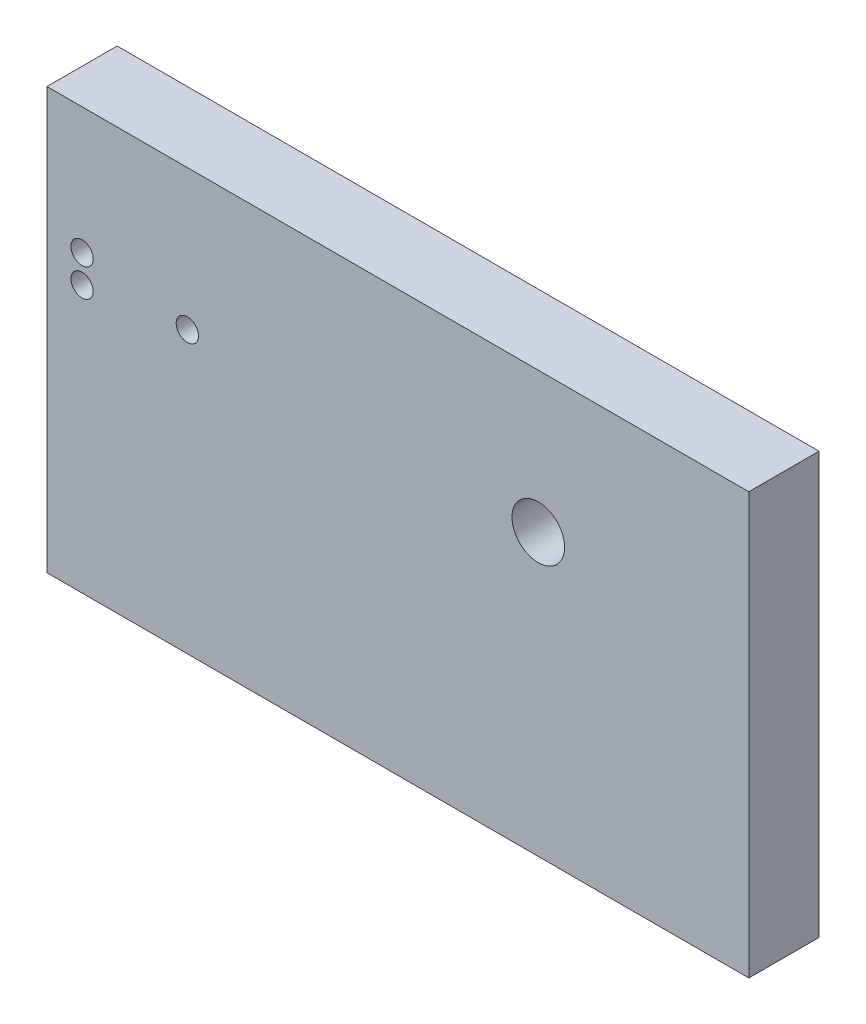
from build123d import *

# Parameters (mm, degrees)
SKETCH1_W                       = 127
SKETCH1_H                       = 76.2
BOSS_EXTRUDE1_DEPTH             = 12.7
F_1_32_0_159_DIAMETER_HOLE1_D   = 4.0386
F_10_32_TAPPED_HOLE1_D          = 4.0386
F_10_32_TAPPED_HOLE1_DEPTH      = 11.486682152
F_10_32_TAPPED_HOLE1_TIP        = 1.213317848
F_3_8_0_375_DIAMETER_HOLE1_D    = 9.525
F_10_32_TAPPED_HOLE2_D          = 4.0386
F_10_32_TAPPED_HOLE2_DEPTH      = 14.478
F_10_32_TAPPED_HOLE2_TIP        = 1.213317848
F_21_0_159_DIAMETER_HOLE1_D     = 4.0386
F_21_0_159_DIAMETER_HOLE1_DEPTH = 14.478
F_21_0_159_DIAMETER_HOLE1_TIP   = 1.213317848


with BuildPart() as part:
    # Sketch1 → Boss-Extrude1 (new body)
    with BuildSketch(Plane.XY):
        with Locations((63.5, 38.1)):
            Rectangle(SKETCH1_W, SKETCH1_H)
    extrude(amount=BOSS_EXTRUDE1_DEPTH)

    # 1/32 (0.159) Diameter Hole1 (through all)
    with Locations(Plane.XY.offset(12.7)):
        with Locations((25.4, 50.8)):
            Hole(F_1_32_0_159_DIAMETER_HOLE1_D / 2)

    # #10-32 Tapped Hole1
    with Locations(Plane(origin=(0, 0, 0), x_dir=(-1, 0, 0), z_dir=(0, -1, 0))):
        with Locations((-19.05, -6.35), (-107.95, -6.35)):
            Hole(F_10_32_TAPPED_HOLE1_D / 2, depth=F_10_32_TAPPED_HOLE1_DEPTH)
            with Locations((0, 0, -(F_10_32_TAPPED_HOLE1_DEPTH + F_10_32_TAPPED_HOLE1_TIP / 2))):  # 118° drill point
                Cone(0, F_10_32_TAPPED_HOLE1_D / 2, F_10_32_TAPPED_HOLE1_TIP, mode=Mode.SUBTRACT)

    # 3/8 (0.375) Diameter Hole1 (through all)
    with Locations(Plane.XY.offset(12.7)):
        with Locations((88.9, 50.8)):
            Hole(F_3_8_0_375_DIAMETER_HOLE1_D / 2)

    # #10-32 Tapped Hole2
    with Locations(Plane.XY.offset(12.7)):
        with Locations((6.35, 48.26)):
            Hole(F_10_32_TAPPED_HOLE2_D / 2, depth=F_10_32_TAPPED_HOLE2_DEPTH)
            with Locations((0, 0, -(F_10_32_TAPPED_HOLE2_DEPTH + F_10_32_TAPPED_HOLE2_TIP / 2))):  # 118° drill point
                Cone(0, F_10_32_TAPPED_HOLE2_D / 2, F_10_32_TAPPED_HOLE2_TIP, mode=Mode.SUBTRACT)

    # #21 (0.159) Diameter Hole1
    with Locations(Plane.XY.offset(12.7)):
        with Locations((6.35, 53.34)):
            Hole(F_21_0_159_DIAMETER_HOLE1_D / 2, depth=F_21_0_159_DIAMETER_HOLE1_DEPTH)
            with Locations((0, 0, -(F_21_0_159_DIAMETER_HOLE1_DEPTH + F_21_0_159_DIAMETER_HOLE1_TIP / 2))):  # 118° drill point
                Cone(0, F_21_0_159_DIAMETER_HOLE1_D / 2, F_21_0_159_DIAMETER_HOLE1_TIP, mode=Mode.SUBTRACT)


solid = part.part
